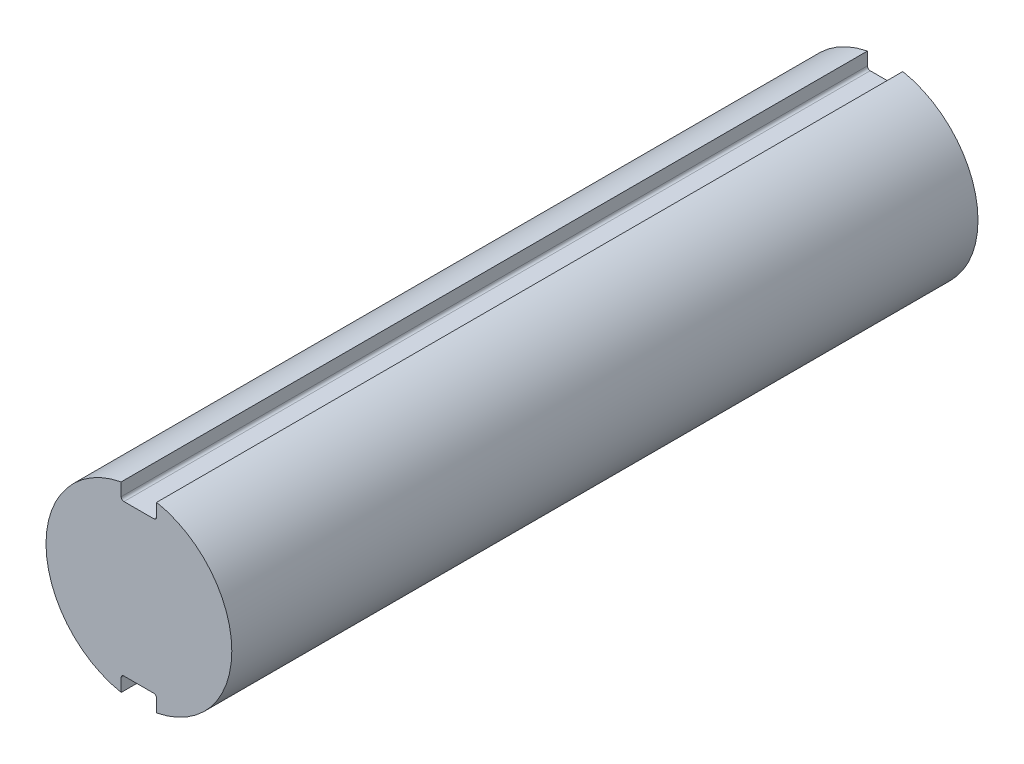
from build123d import *

# Parameters (mm, degrees)
Y_KSEKLIK_EKSTR_ZYON3_DEPTH = 200


with BuildPart() as part:
    # Model → Yükseklik-Ekstrüzyon3 (new body)
    with BuildSketch(Plane.XY):
        with BuildLine():
            Line((-4.75, 21), (-4.75, 24.442739208))
            ThreePointArc((-4.75, 24.442739208), (-24.9, 0), (-4.75, -24.442739208))
            Line((-4.75, -24.442739208), (-4.75, -21))
            ThreePointArc((-4.75, -21), (-4.530330086, -20.469669914), (-4, -20.25))
            Line((-4, -20.25), (0, -20.25))
            Line((0, -20.25), (4, -20.25))
            ThreePointArc((4, -20.25), (4.530330086, -20.469669914), (4.75, -21))
            Line((4.75, -21), (4.75, -24.442739208))
            ThreePointArc((4.75, -24.442739208), (24.9, 0), (4.75, 24.442739208))
            Line((4.75, 24.442739208), (4.75, 21))
            ThreePointArc((4.75, 21), (4.530330086, 20.469669914), (4, 20.25))
            Line((4, 20.25), (0, 20.25))
            Line((0, 20.25), (-4, 20.25))
            ThreePointArc((-4, 20.25), (-4.530330086, 20.469669914), (-4.75, 21))
        make_face()
    extrude(amount=Y_KSEKLIK_EKSTR_ZYON3_DEPTH)


solid = part.part
